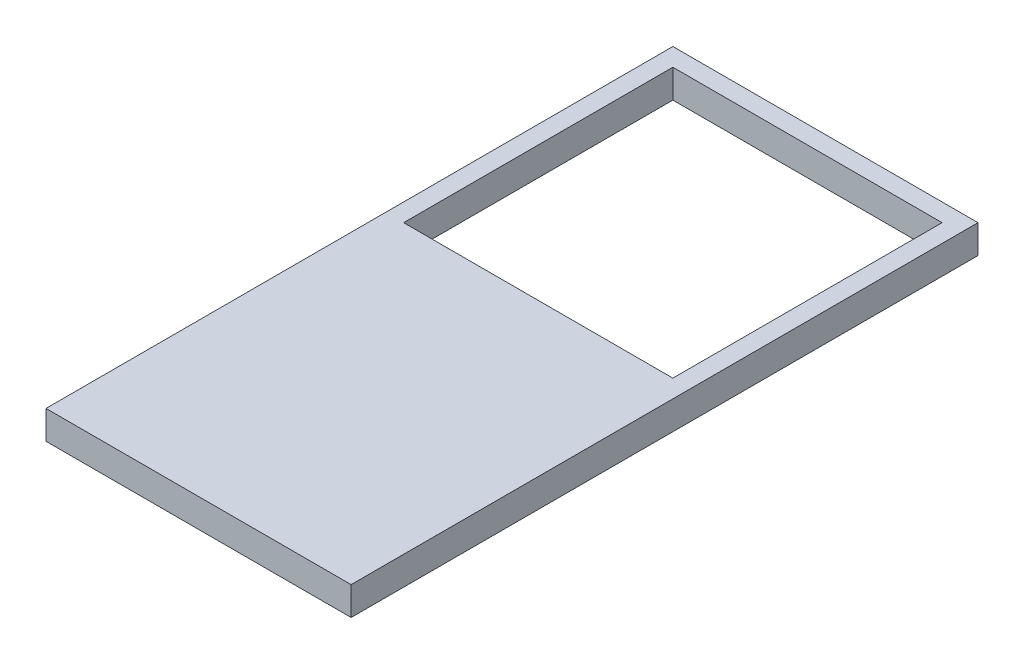
from build123d import *

# Parameters (mm, degrees)
SKETCH1_W           = 17
SKETCH1_H           = 1.5875
BOSS_EXTRUDE1_DEPTH = 34.925
SKETCH2_W           = 15
SKETCH2_H           = 15
CUT_EXTRUDE1_DEPTH  = 39.875130627


with BuildPart() as part:
    # Sketch1 → Boss-Extrude1 (new body)
    with BuildSketch(Plane.XY):
        with Locations((8.5, 0.79375)):
            Rectangle(SKETCH1_W, SKETCH1_H)
    extrude(amount=BOSS_EXTRUDE1_DEPTH)

    # Sketch2 → Cut-Extrude1 (cut, through all)
    with BuildSketch(Plane(origin=(0, 1.5875, 0), x_dir=(1, 0, 0), z_dir=(0, 1, 0))):
        with Locations((8.5, -8.5)):
            Rectangle(SKETCH2_W, SKETCH2_H)
    extrude(amount=-CUT_EXTRUDE1_DEPTH, mode=Mode.SUBTRACT)


solid = part.part
